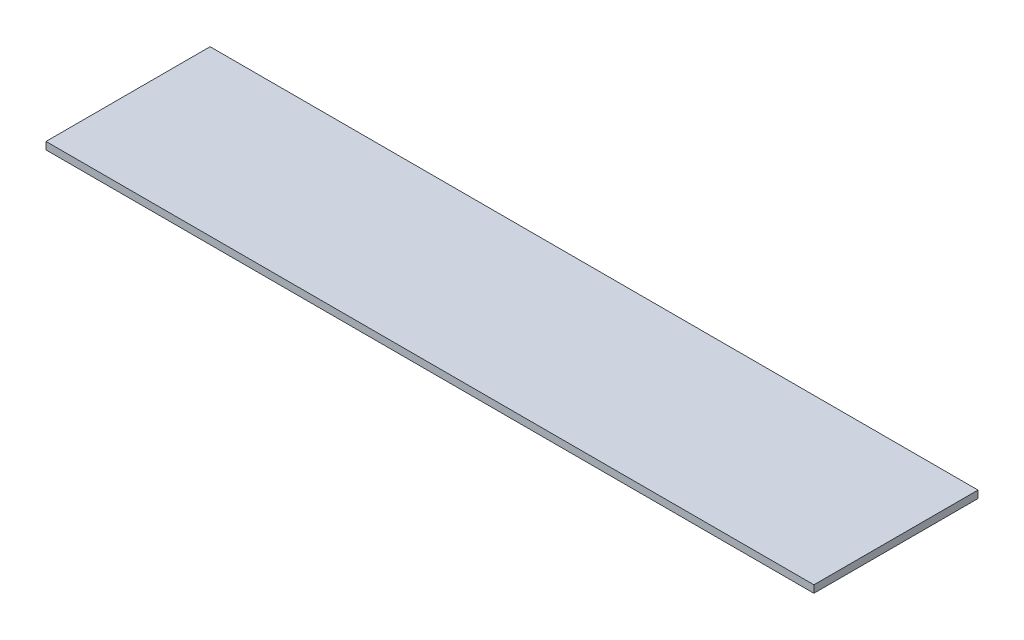
from build123d import *

# Parameters (mm, degrees)
SKETCH_1_W      = 1872
SKETCH_1_H      = 400
EXTRUDE_1_DEPTH = 18


with BuildPart() as part:
    # 草图1 → 凸台-拉伸1 (new body)
    with BuildSketch(Plane(origin=(0, 0, 0), x_dir=(1, 0, 0), z_dir=(0, 1, 0))):
        with Locations((473.126760563, 31.436619718)):
            Rectangle(SKETCH_1_W, SKETCH_1_H)
    extrude(amount=EXTRUDE_1_DEPTH)


solid = part.part
